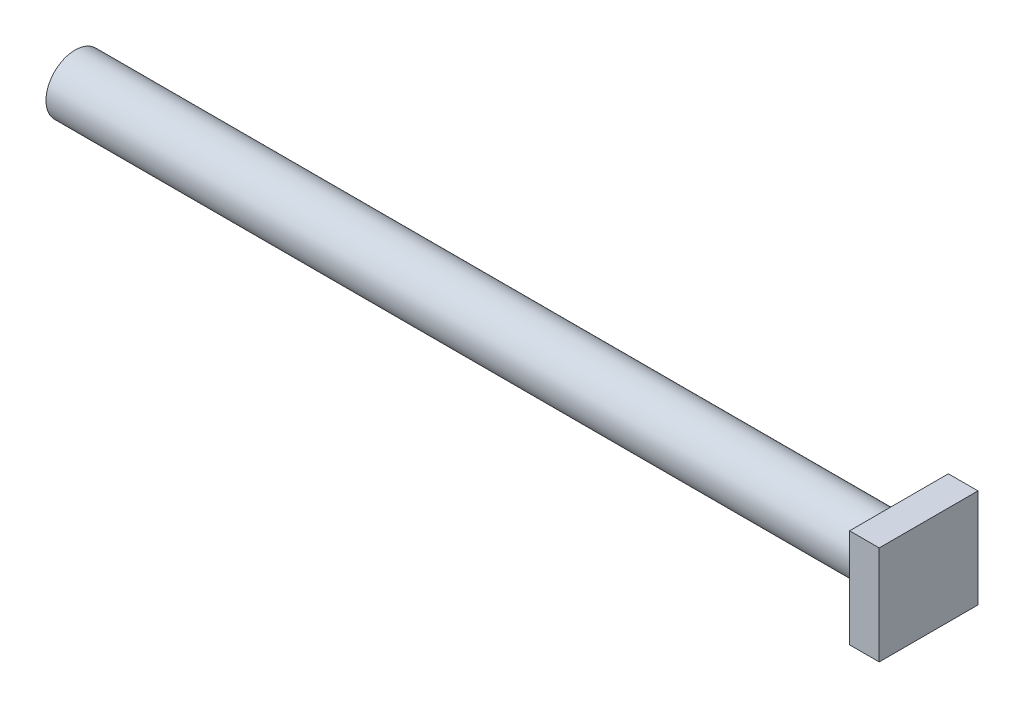
from build123d import *

# Parameters (mm, degrees)
SKETCH3_R           = 2.95
BOSS_EXTRUDE1_DEPTH = 83.4
SKETCH4_W           = 10
SKETCH4_H           = 10
BOSS_EXTRUDE2_DEPTH = 3


with BuildPart() as part:
    # Sketch3 → Boss-Extrude1 (new body)
    with BuildSketch(Plane(origin=(0, 0, 0), x_dir=(0, 0, -1), z_dir=(1, 0, 0))):
        Circle(SKETCH3_R)
    extrude(amount=-BOSS_EXTRUDE1_DEPTH)

    # Sketch4 → Boss-Extrude2 (add)
    with BuildSketch(Plane(origin=(0, 0, 0), x_dir=(0, 0, -1), z_dir=(1, 0, 0))):
        Rectangle(SKETCH4_W, SKETCH4_H)
    extrude(amount=BOSS_EXTRUDE2_DEPTH)


solid = part.part
